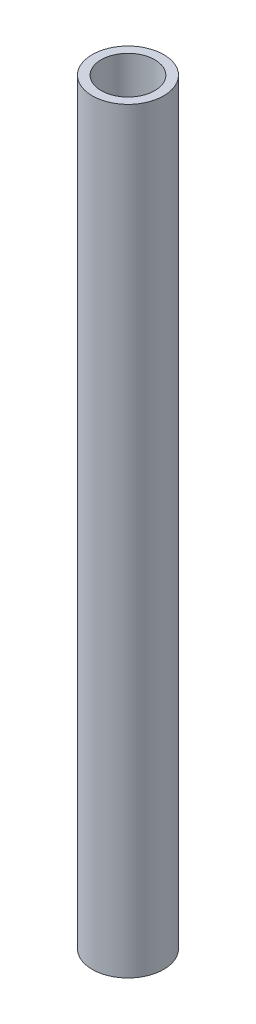
from build123d import *

# Parameters (mm, degrees)
SKETCH1_R           = 12
BOSS_EXTRUDE1_DEPTH = 254
SKETCH2_R           = 9
CUT_EXTRUDE1_DEPTH  = 254


with BuildPart() as part:
    # Sketch1 → Boss-Extrude1 (new body)
    with BuildSketch(Plane(origin=(0, 0, 0), x_dir=(1, 0, 0), z_dir=(0, 1, 0))):
        with Locations(Location((0, 0, 0), (0, 0, 270))):
            Circle(SKETCH1_R)
    extrude(amount=BOSS_EXTRUDE1_DEPTH)

    # Sketch2 → Cut-Extrude1 (cut)
    with BuildSketch(Plane(origin=(0, 254, 0), x_dir=(1, 0, 0), z_dir=(0, 1, 0))):
        with Locations(Location((0, 0, 0), (0, 0, 270))):
            Circle(SKETCH2_R)
    extrude(amount=-CUT_EXTRUDE1_DEPTH, mode=Mode.SUBTRACT)


solid = part.part
